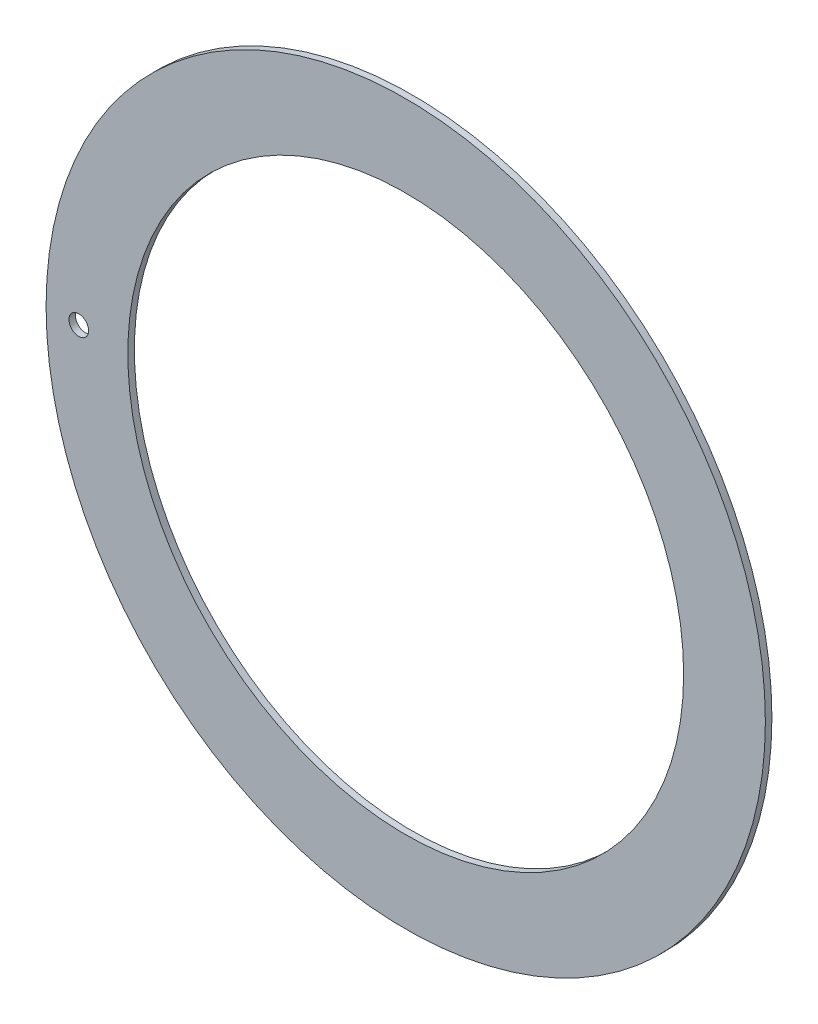
from build123d import *

# Parameters (mm, degrees)
SKETCH_1_R      = 55
SKETCH_1_R_2    = 42.5
SKETCH_1_R_3    = 1.5
EXTRUDE_1_DEPTH = 1


with BuildPart() as part:
    # 草图1 → 凸台-拉伸1 (new body)
    with BuildSketch(Plane.XY):
        with Locations((3830.05688408, 134.884780453)):
            Circle(SKETCH_1_R)
        with Locations((3830.05688408, 134.884780453)):
            Circle(SKETCH_1_R_2, mode=Mode.SUBTRACT)
        with Locations((3780.05688408, 134.884780453)):
            Circle(SKETCH_1_R_3, mode=Mode.SUBTRACT)
    extrude(amount=EXTRUDE_1_DEPTH)


solid = part.part
